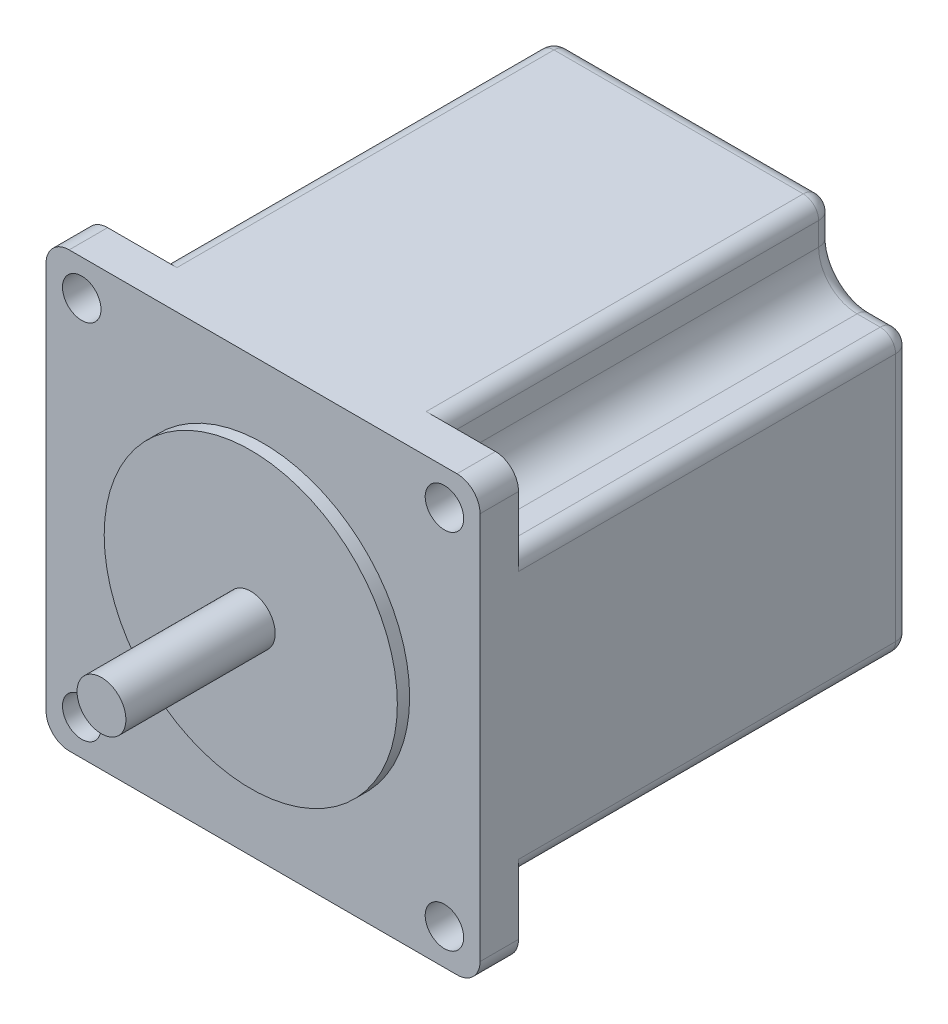
from build123d import *

# Parameters (mm, degrees)
SKETCH1_R           = 2.5
BOSS_EXTRUDE2_DEPTH = 56
CUT_EXTRUDE1_DEPTH  = 65.741640387
SKETCH3_R           = 19.05
BOSS_EXTRUDE3_DEPTH = 1.6
SKETCH4_R           = 3.175
BOSS_EXTRUDE4_DEPTH = 21
FILLET1_R           = 2


with BuildPart() as part:
    # Sketch1 → Boss-Extrude2 (new body)
    with BuildSketch(Plane.XY):
        with BuildLine():
            Line((-25.2, 28.2), (25.2, 28.2))
            ThreePointArc((25.2, 28.2), (27.321320344, 27.321320344), (28.2, 25.2))
            Line((28.2, 25.2), (28.2, -25.2))
            ThreePointArc((28.2, -25.2), (27.321320344, -27.321320344), (25.2, -28.2))
            Line((25.2, -28.2), (-25.2, -28.2))
            ThreePointArc((-25.2, -28.2), (-27.321320344, -27.321320344), (-28.2, -25.2))
            Line((-28.2, -25.2), (-28.2, 25.2))
            ThreePointArc((-28.2, 25.2), (-27.321320344, 27.321320344), (-25.2, 28.2))
        make_face()
        with Locations((23.57, 23.57)):
            Circle(SKETCH1_R, mode=Mode.SUBTRACT)
        with Locations((-23.57, 23.57)):
            Circle(SKETCH1_R, mode=Mode.SUBTRACT)
        with Locations((-23.57, -23.57)):
            Circle(SKETCH1_R, mode=Mode.SUBTRACT)
        with Locations((23.57, -23.57)):
            Circle(SKETCH1_R, mode=Mode.SUBTRACT)
    extrude(amount=-BOSS_EXTRUDE2_DEPTH)

    # Sketch2 → Cut-Extrude1 (cut, through all)
    with BuildSketch(Plane.XY.offset(-5)):
        with BuildLine():
            Line((18.2, 28.2), (18.2, 23.2))
            ThreePointArc((18.2, 23.2), (19.664466094, 19.664466094), (23.2, 18.2))
            Line((23.2, 18.2), (28.2, 18.2))
            Line((28.2, 18.2), (28.2, 25.2))
            ThreePointArc((28.2, 25.2), (27.321320344, 27.321320344), (25.2, 28.2))
            Line((25.2, 28.2), (18.2, 28.2))
        make_face()
        with BuildLine():
            Line((-28.2, 18.2), (-28.2, 25.2))
            ThreePointArc((-28.2, 25.2), (-27.321320344, 27.321320344), (-25.2, 28.2))
            Line((-25.2, 28.2), (-18.2, 28.2))
            Line((-18.2, 28.2), (-18.2, 23.2))
            ThreePointArc((-18.2, 23.2), (-19.664466094, 19.664466094), (-23.2, 18.2))
            Line((-23.2, 18.2), (-28.2, 18.2))
        make_face()
        with BuildLine():
            Line((-18.2, -28.2), (-18.2, -23.2))
            ThreePointArc((-18.2, -23.2), (-19.664466094, -19.664466094), (-23.2, -18.2))
            Line((-23.2, -18.2), (-28.2, -18.2))
            Line((-28.2, -18.2), (-28.2, -25.2))
            ThreePointArc((-28.2, -25.2), (-27.321320344, -27.321320344), (-25.2, -28.2))
            Line((-25.2, -28.2), (-18.2, -28.2))
        make_face()
        with BuildLine():
            Line((28.2, -18.2), (28.2, -25.2))
            ThreePointArc((28.2, -25.2), (27.321320344, -27.321320344), (25.2, -28.2))
            Line((25.2, -28.2), (18.2, -28.2))
            Line((18.2, -28.2), (18.2, -23.2))
            ThreePointArc((18.2, -23.2), (19.664466094, -19.664466094), (23.2, -18.2))
            Line((23.2, -18.2), (28.2, -18.2))
        make_face()
    extrude(amount=-CUT_EXTRUDE1_DEPTH, mode=Mode.SUBTRACT)

    # Sketch3 → Boss-Extrude3 (add)
    with BuildSketch(Plane.XY):
        Circle(SKETCH3_R)
    extrude(amount=BOSS_EXTRUDE3_DEPTH)

    # Sketch4 → Boss-Extrude4 (add)
    with BuildSketch(Plane.XY):
        with Locations(Location((0, 0, 0), (0, 0, 180))):
            Circle(SKETCH4_R)
    extrude(amount=BOSS_EXTRUDE4_DEPTH)

    # Fillet1
    fillet1_edges = [part.edges().sort_by_distance(p)[0] for p in [
        (-25.7, -18.2, -56),
        (-28.2, -18.2, -30.5),
        (-19.664466094, -19.664466094, -56),
        (-18.2, -25.7, -56),
        (-18.2, -28.2, -30.5),
        (0, 28.2, -56),
        (18.2, 28.2, -30.5),
        (25.7, 18.2, -56),
        (28.2, 18.2, -30.5),
        (19.664466094, 19.664466094, -56),
        (18.2, 25.7, -56),
        (-28.2, 0, -56),
        (-18.2, 25.7, -56),
        (-18.2, 28.2, -30.5),
        (-19.664466094, 19.664466094, -56),
        (-25.7, 18.2, -56),
        (-28.2, 18.2, -30.5),
        (28.2, 0, -56),
        (18.2, -25.7, -56),
        (18.2, -28.2, -30.5),
        (19.664466094, -19.664466094, -56),
        (25.7, -18.2, -56),
        (28.2, -18.2, -30.5),
        (0, -28.2, -56),
    ]]
    fillet(fillet1_edges, radius=FILLET1_R)


solid = part.part
